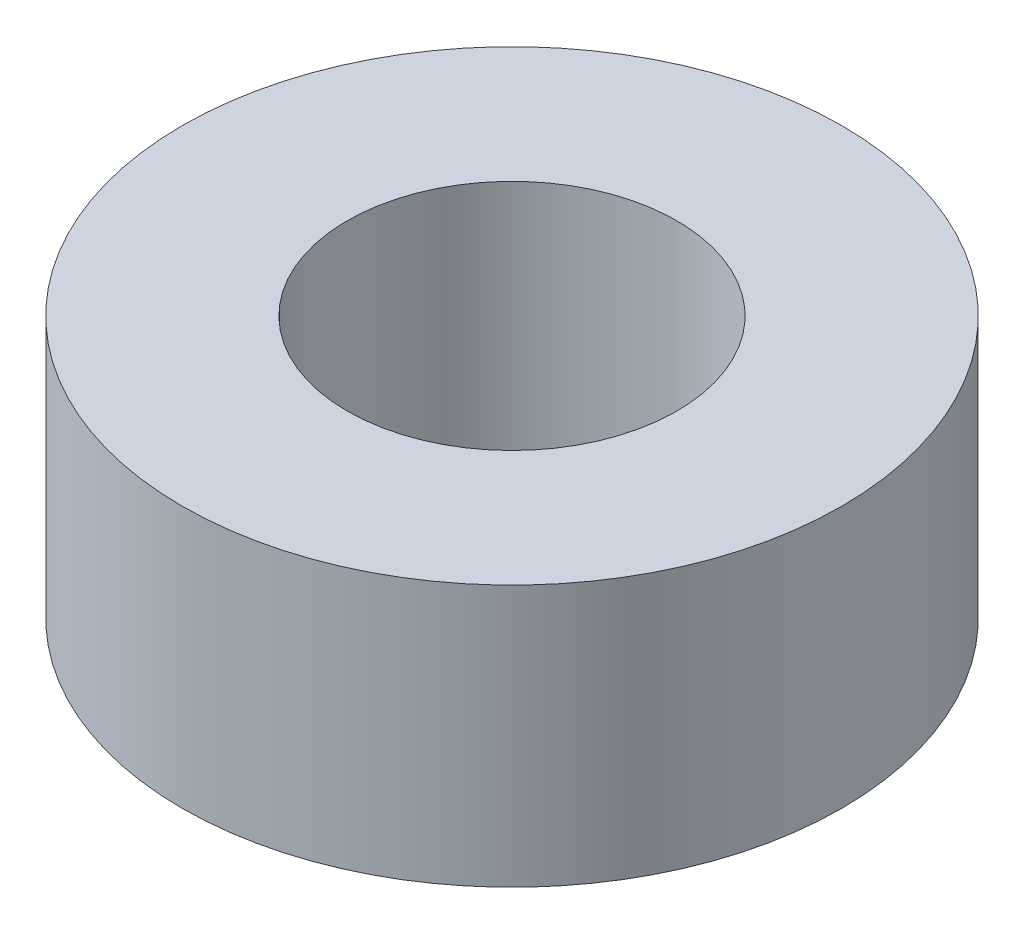
from build123d import *

# Parameters (mm, degrees)
SKETCH1_R           = 8
SKETCH1_R_2         = 4
BOSS_EXTRUDE1_DEPTH = 3.175


with BuildPart() as part:
    # Sketch1 → Boss-Extrude1 (new, symmetric)
    with BuildSketch(Plane(origin=(0, 0, 0), x_dir=(1, 0, 0), z_dir=(0, 1, 0))):
        with Locations(Location((0, 0, 0), (0, 0, 270))):
            Circle(SKETCH1_R)
        with Locations(Location((0, 0, 0), (0, 0, 270))):
            Circle(SKETCH1_R_2, mode=Mode.SUBTRACT)
    extrude(amount=BOSS_EXTRUDE1_DEPTH, both=True)


solid = part.part
